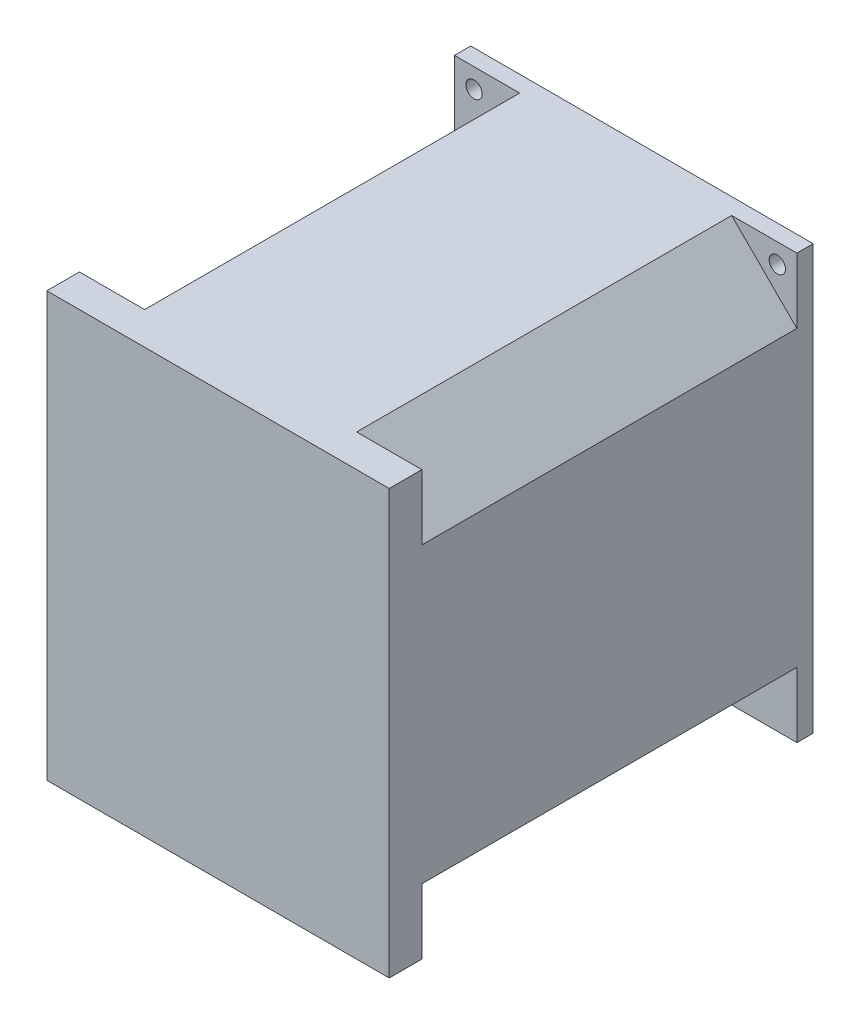
from build123d import *

# Parameters (mm, degrees)
ESQUISSE1_W             = 130
ESQUISSE1_H             = 130
BASE_EXTRUSION_DEPTH    = 105
ENL_V_MAT_EXTRU_1_DEPTH = 115
ESQUISSE4_R             = 2.5
ENL_V_MAT_EXTRU_2_DEPTH = 5


with BuildPart() as part:
    # Esquisse1 → Base-Extrusion (new body)
    with BuildSketch(Plane(origin=(0, 0, 0), x_dir=(0, 0, -1), z_dir=(1, 0, 0))):
        with Locations((65, 65)):
            Rectangle(ESQUISSE1_W, ESQUISSE1_H)
    extrude(amount=BASE_EXTRUSION_DEPTH)

    # Esquisse3 → Enlèv. mat.-Extru.1 (cut)
    with BuildSketch(Plane.XY.offset(-10)):
        Polygon((0, 0), (20, 0), (0, 20), align=None)
        Polygon((0, 130), (0, 110), (20, 130), align=None)
        Polygon((105, 130), (105, 110), (85, 130), align=None)
        Polygon((105, 0), (105, 20), (85, 0), align=None)
    extrude(amount=-ENL_V_MAT_EXTRU_1_DEPTH, mode=Mode.SUBTRACT)

    # Esquisse4 → Enlèv. mat.-Extru.2 (cut)
    with BuildSketch(Plane(origin=(0, 0, -130), x_dir=(-1, 0, 0), z_dir=(0, 0, -1))):
        with Locations((-6, 124)):
            Circle(ESQUISSE4_R)
        with Locations((-99, 124)):
            Circle(ESQUISSE4_R)
    extrude(amount=-ENL_V_MAT_EXTRU_2_DEPTH, mode=Mode.SUBTRACT)


solid = part.part
